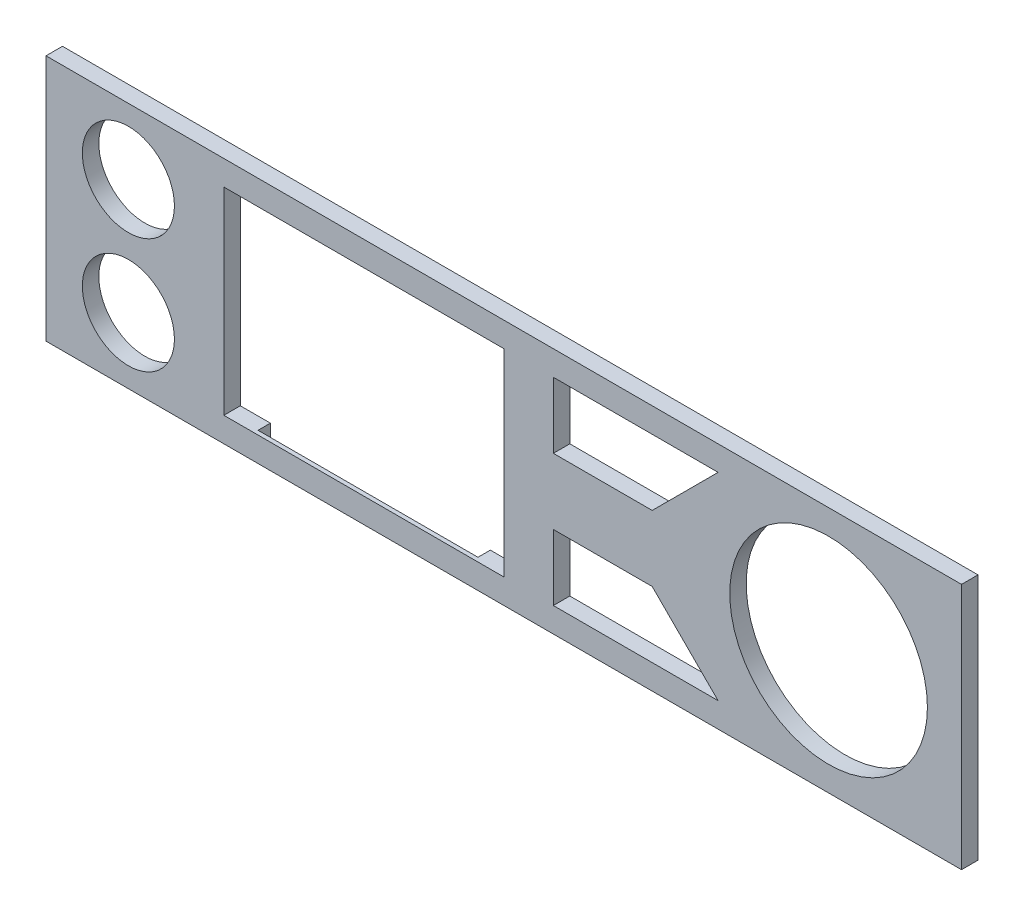
from build123d import *

# Parameters (mm, degrees)
SKETCH2_W           = 111.14
SKETCH2_H           = 30
SKETCH2_R           = 5.59
SKETCH2_R_2         = 12
SKETCH2_W_2         = 34
SKETCH2_H_2         = 24
BOSS_EXTRUDE1_DEPTH = 2
SKETCH3_W           = 26.7
SKETCH3_H           = 2.25
CUT_EXTRUDE1_DEPTH  = 1.5


with BuildPart() as part:
    # Sketch2 → Boss-Extrude1 (new body)
    with BuildSketch(Plane.XY):
        with Locations((-55.57, 15)):
            Rectangle(SKETCH2_W, SKETCH2_H)
        with Locations((-101.14, 22)):
            Circle(SKETCH2_R, mode=Mode.SUBTRACT)
        with Locations((-101.14, 8)):
            Circle(SKETCH2_R, mode=Mode.SUBTRACT)
        with Locations((-16.14, 15)):
            Circle(SKETCH2_R_2, mode=Mode.SUBTRACT)
        Polygon((-36.596, 27), (-29.55, 27), (-37.55, 19), (-49.55, 19), (-49.55, 27), align=None, mode=Mode.SUBTRACT)
        Polygon((-49.55, 3), (-37.006, 3), (-29.55, 3), (-37.55, 11), (-49.55, 11), align=None, mode=Mode.SUBTRACT)
        with Locations((-72.55, 15)):
            Rectangle(SKETCH2_W_2, SKETCH2_H_2, mode=Mode.SUBTRACT)
    extrude(amount=BOSS_EXTRUDE1_DEPTH)

    # Sketch3 → Cut-Extrude1 (cut)
    with BuildSketch(Plane(origin=(0, 0, 0), x_dir=(-1, 0, 0), z_dir=(0, 0, -1))):
        with Locations((72.55, 1.875)):
            Rectangle(SKETCH3_W, SKETCH3_H)
    extrude(amount=-CUT_EXTRUDE1_DEPTH, mode=Mode.SUBTRACT)


solid = part.part
